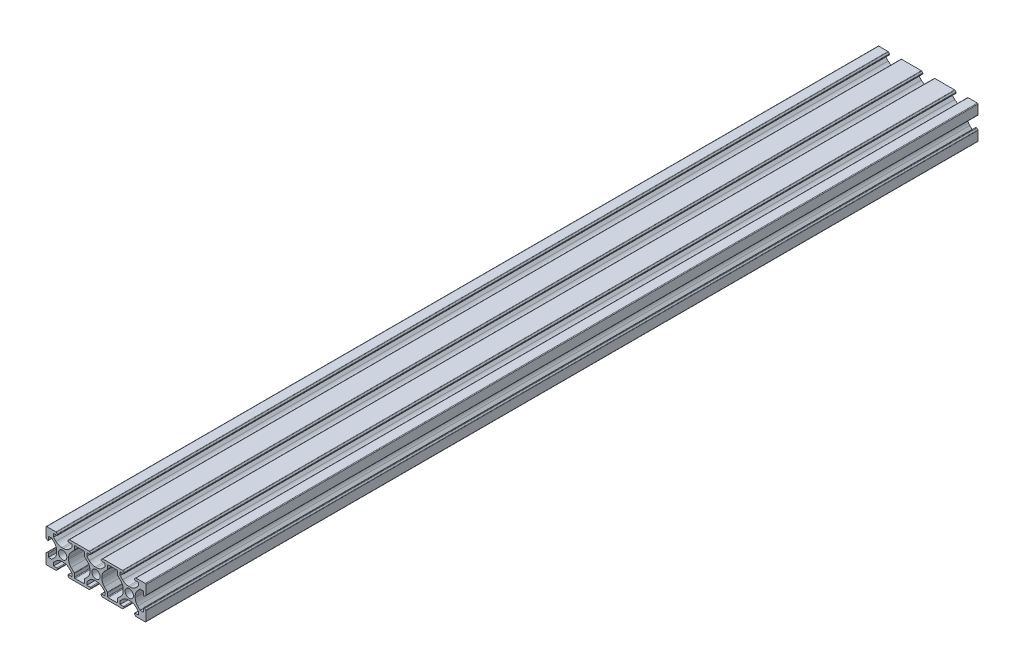
from build123d import *

# Parameters (mm, degrees)
RESSALTO_EXTRUS_O1_DEPTH    = 500
PADR_OCIRCULAR1_COUNT       = 4
PADR_O_LINEAR1_COUNT        = 3
PADR_O_LINEAR1_PITCH        = 20
PADR_O_LINEAR1_COPY_1_DEPTH = 500
PADR_O_LINEAR1_COPY_2_DEPTH = 500
PADR_O_LINEAR1_COPY_3_DEPTH = 500
PADR_O_LINEAR1_COPY_4_DEPTH = 500
PADR_O_LINEAR1_COPY_5_DEPTH = 500
PADR_O_LINEAR1_COPY_6_DEPTH = 500
CORTE_EXTRUS_O1_DEPTH       = 503.593274925
PADR_O_LINEAR2_COUNT        = 2
PADR_O_LINEAR2_PITCH        = 20
FILETE1_R                   = 0.4
FILETE2_R                   = 0.4


with BuildPart() as part:
    # Esboço1 → Ressalto-extrusão1 (new body)
    with BuildSketch(Plane.XY):
        with BuildLine():
            ThreePointArc((-9.317157288, 3.217157288), (-9.187387948, 3.130448187), (-9.034314575, 3.1))
            Line((-9.034314575, 3.1), (-8.9, 3.1))
            ThreePointArc((-8.9, 3.1), (-8.617157288, 3.217157288), (-8.5, 3.5))
            Line((-8.5, 3.5), (-8.5, 5.5))
            Line((-8.5, 5.5), (-6.560660172, 5.5))
            Line((-6.560660172, 5.5), (-5.064466094, 4.003805922))
            ThreePointArc((-5.064466094, 4.003805922), (-3.980602337, 2.381689178), (-3.6, 0.468272016))
            Line((-3.6, 0.468272016), (-3.6, 0))
            Line((-3.6, 0), (-2.5, 0))
            ThreePointArc((-2.5, 0), (-1.767766953, 1.767766953), (0, 2.5))
            Line((0, 2.5), (0, 3.6))
            Line((0, 3.6), (-0.468272016, 3.6))
            ThreePointArc((-0.468272016, 3.6), (-2.381689178, 3.980602337), (-4.003805922, 5.064466094))
            Line((-4.003805922, 5.064466094), (-5.5, 6.560660172))
            Line((-5.5, 6.560660172), (-5.5, 8.5))
            Line((-5.5, 8.5), (-3.5, 8.5))
            ThreePointArc((-3.5, 8.5), (-3.217157288, 8.617157288), (-3.1, 8.9))
            Line((-3.1, 8.9), (-3.1, 9.034314575))
            ThreePointArc((-3.1, 9.034314575), (-3.130448187, 9.187387948), (-3.217157288, 9.317157288))
            Line((-3.217157288, 9.317157288), (-3.782842712, 9.882842712))
            ThreePointArc((-3.782842712, 9.882842712), (-3.912612052, 9.969551813), (-4.065685425, 10))
            Line((-4.065685425, 10), (-10, 10))
            Line((-10, 10), (-10, 4.065685425))
            ThreePointArc((-10, 4.065685425), (-9.969551813, 3.912612052), (-9.882842712, 3.782842712))
            Line((-9.882842712, 3.782842712), (-9.317157288, 3.217157288))
        make_face()
    ressalto_extrus_o1 = extrude(amount=RESSALTO_EXTRUS_O1_DEPTH)

    # PadrãoCircular1: Ressalto-extrusão1 ×4 about axis
    padr_ocircular1_axis = Axis((0, 0, 0), (0, 0, 1))
    for i in range(1, PADR_OCIRCULAR1_COUNT):
        add(ressalto_extrus_o1.rotate(padr_ocircular1_axis, i * 360 / PADR_OCIRCULAR1_COUNT))

    # Padrão linear1: Ressalto-extrusão1 ×3
    with Locations(*[(i * PADR_O_LINEAR1_PITCH, 0, 0) for i in range(1, PADR_O_LINEAR1_COUNT)]):
        add(ressalto_extrus_o1)

    # Padrão linear1 copy 1 sketch → Padrão linear1 copy 1 (add)
    with BuildSketch(Plane(origin=(20, 0, 0), x_dir=(0, 1, 0), z_dir=(0, 0, 1))):
        with BuildLine():
            ThreePointArc((-9.317157288, 3.217157288), (-9.187387948, 3.130448187), (-9.034314575, 3.1))
            Line((-9.034314575, 3.1), (-8.9, 3.1))
            ThreePointArc((-8.9, 3.1), (-8.617157288, 3.217157288), (-8.5, 3.5))
            Line((-8.5, 3.5), (-8.5, 5.5))
            Line((-8.5, 5.5), (-6.560660172, 5.5))
            Line((-6.560660172, 5.5), (-5.064466094, 4.003805922))
            ThreePointArc((-5.064466094, 4.003805922), (-3.980602337, 2.381689178), (-3.6, 0.468272016))
            Line((-3.6, 0.468272016), (-3.6, 0))
            Line((-3.6, 0), (-2.5, 0))
            ThreePointArc((-2.5, 0), (-1.767766953, 1.767766953), (0, 2.5))
            Line((0, 2.5), (0, 3.6))
            Line((0, 3.6), (-0.468272016, 3.6))
            ThreePointArc((-0.468272016, 3.6), (-2.381689178, 3.980602337), (-4.003805922, 5.064466094))
            Line((-4.003805922, 5.064466094), (-5.5, 6.560660172))
            Line((-5.5, 6.560660172), (-5.5, 8.5))
            Line((-5.5, 8.5), (-3.5, 8.5))
            ThreePointArc((-3.5, 8.5), (-3.217157288, 8.617157288), (-3.1, 8.9))
            Line((-3.1, 8.9), (-3.1, 9.034314575))
            ThreePointArc((-3.1, 9.034314575), (-3.130448187, 9.187387948), (-3.217157288, 9.317157288))
            Line((-3.217157288, 9.317157288), (-3.782842712, 9.882842712))
            ThreePointArc((-3.782842712, 9.882842712), (-3.912612052, 9.969551813), (-4.065685425, 10))
            Line((-4.065685425, 10), (-10, 10))
            Line((-10, 10), (-10, 4.065685425))
            ThreePointArc((-10, 4.065685425), (-9.969551813, 3.912612052), (-9.882842712, 3.782842712))
            Line((-9.882842712, 3.782842712), (-9.317157288, 3.217157288))
        make_face()
    extrude(amount=PADR_O_LINEAR1_COPY_1_DEPTH)

    # Padrão linear1 copy 2 sketch → Padrão linear1 copy 2 (add)
    with BuildSketch(Plane(origin=(40, 0, 0), x_dir=(0, 1, 0), z_dir=(0, 0, 1))):
        with BuildLine():
            ThreePointArc((-9.317157288, 3.217157288), (-9.187387948, 3.130448187), (-9.034314575, 3.1))
            Line((-9.034314575, 3.1), (-8.9, 3.1))
            ThreePointArc((-8.9, 3.1), (-8.617157288, 3.217157288), (-8.5, 3.5))
            Line((-8.5, 3.5), (-8.5, 5.5))
            Line((-8.5, 5.5), (-6.560660172, 5.5))
            Line((-6.560660172, 5.5), (-5.064466094, 4.003805922))
            ThreePointArc((-5.064466094, 4.003805922), (-3.980602337, 2.381689178), (-3.6, 0.468272016))
            Line((-3.6, 0.468272016), (-3.6, 0))
            Line((-3.6, 0), (-2.5, 0))
            ThreePointArc((-2.5, 0), (-1.767766953, 1.767766953), (0, 2.5))
            Line((0, 2.5), (0, 3.6))
            Line((0, 3.6), (-0.468272016, 3.6))
            ThreePointArc((-0.468272016, 3.6), (-2.381689178, 3.980602337), (-4.003805922, 5.064466094))
            Line((-4.003805922, 5.064466094), (-5.5, 6.560660172))
            Line((-5.5, 6.560660172), (-5.5, 8.5))
            Line((-5.5, 8.5), (-3.5, 8.5))
            ThreePointArc((-3.5, 8.5), (-3.217157288, 8.617157288), (-3.1, 8.9))
            Line((-3.1, 8.9), (-3.1, 9.034314575))
            ThreePointArc((-3.1, 9.034314575), (-3.130448187, 9.187387948), (-3.217157288, 9.317157288))
            Line((-3.217157288, 9.317157288), (-3.782842712, 9.882842712))
            ThreePointArc((-3.782842712, 9.882842712), (-3.912612052, 9.969551813), (-4.065685425, 10))
            Line((-4.065685425, 10), (-10, 10))
            Line((-10, 10), (-10, 4.065685425))
            ThreePointArc((-10, 4.065685425), (-9.969551813, 3.912612052), (-9.882842712, 3.782842712))
            Line((-9.882842712, 3.782842712), (-9.317157288, 3.217157288))
        make_face()
    extrude(amount=PADR_O_LINEAR1_COPY_2_DEPTH)

    # Padrão linear1 copy 3 sketch → Padrão linear1 copy 3 (add)
    with BuildSketch(Plane(origin=(20, 0, 0), x_dir=(-1, 0, 0), z_dir=(0, 0, 1))):
        with BuildLine():
            ThreePointArc((-9.317157288, 3.217157288), (-9.187387948, 3.130448187), (-9.034314575, 3.1))
            Line((-9.034314575, 3.1), (-8.9, 3.1))
            ThreePointArc((-8.9, 3.1), (-8.617157288, 3.217157288), (-8.5, 3.5))
            Line((-8.5, 3.5), (-8.5, 5.5))
            Line((-8.5, 5.5), (-6.560660172, 5.5))
            Line((-6.560660172, 5.5), (-5.064466094, 4.003805922))
            ThreePointArc((-5.064466094, 4.003805922), (-3.980602337, 2.381689178), (-3.6, 0.468272016))
            Line((-3.6, 0.468272016), (-3.6, 0))
            Line((-3.6, 0), (-2.5, 0))
            ThreePointArc((-2.5, 0), (-1.767766953, 1.767766953), (0, 2.5))
            Line((0, 2.5), (0, 3.6))
            Line((0, 3.6), (-0.468272016, 3.6))
            ThreePointArc((-0.468272016, 3.6), (-2.381689178, 3.980602337), (-4.003805922, 5.064466094))
            Line((-4.003805922, 5.064466094), (-5.5, 6.560660172))
            Line((-5.5, 6.560660172), (-5.5, 8.5))
            Line((-5.5, 8.5), (-3.5, 8.5))
            ThreePointArc((-3.5, 8.5), (-3.217157288, 8.617157288), (-3.1, 8.9))
            Line((-3.1, 8.9), (-3.1, 9.034314575))
            ThreePointArc((-3.1, 9.034314575), (-3.130448187, 9.187387948), (-3.217157288, 9.317157288))
            Line((-3.217157288, 9.317157288), (-3.782842712, 9.882842712))
            ThreePointArc((-3.782842712, 9.882842712), (-3.912612052, 9.969551813), (-4.065685425, 10))
            Line((-4.065685425, 10), (-10, 10))
            Line((-10, 10), (-10, 4.065685425))
            ThreePointArc((-10, 4.065685425), (-9.969551813, 3.912612052), (-9.882842712, 3.782842712))
            Line((-9.882842712, 3.782842712), (-9.317157288, 3.217157288))
        make_face()
    extrude(amount=PADR_O_LINEAR1_COPY_3_DEPTH)

    # Padrão linear1 copy 4 sketch → Padrão linear1 copy 4 (add)
    with BuildSketch(Plane(origin=(40, 0, 0), x_dir=(-1, 0, 0), z_dir=(0, 0, 1))):
        with BuildLine():
            ThreePointArc((-9.317157288, 3.217157288), (-9.187387948, 3.130448187), (-9.034314575, 3.1))
            Line((-9.034314575, 3.1), (-8.9, 3.1))
            ThreePointArc((-8.9, 3.1), (-8.617157288, 3.217157288), (-8.5, 3.5))
            Line((-8.5, 3.5), (-8.5, 5.5))
            Line((-8.5, 5.5), (-6.560660172, 5.5))
            Line((-6.560660172, 5.5), (-5.064466094, 4.003805922))
            ThreePointArc((-5.064466094, 4.003805922), (-3.980602337, 2.381689178), (-3.6, 0.468272016))
            Line((-3.6, 0.468272016), (-3.6, 0))
            Line((-3.6, 0), (-2.5, 0))
            ThreePointArc((-2.5, 0), (-1.767766953, 1.767766953), (0, 2.5))
            Line((0, 2.5), (0, 3.6))
            Line((0, 3.6), (-0.468272016, 3.6))
            ThreePointArc((-0.468272016, 3.6), (-2.381689178, 3.980602337), (-4.003805922, 5.064466094))
            Line((-4.003805922, 5.064466094), (-5.5, 6.560660172))
            Line((-5.5, 6.560660172), (-5.5, 8.5))
            Line((-5.5, 8.5), (-3.5, 8.5))
            ThreePointArc((-3.5, 8.5), (-3.217157288, 8.617157288), (-3.1, 8.9))
            Line((-3.1, 8.9), (-3.1, 9.034314575))
            ThreePointArc((-3.1, 9.034314575), (-3.130448187, 9.187387948), (-3.217157288, 9.317157288))
            Line((-3.217157288, 9.317157288), (-3.782842712, 9.882842712))
            ThreePointArc((-3.782842712, 9.882842712), (-3.912612052, 9.969551813), (-4.065685425, 10))
            Line((-4.065685425, 10), (-10, 10))
            Line((-10, 10), (-10, 4.065685425))
            ThreePointArc((-10, 4.065685425), (-9.969551813, 3.912612052), (-9.882842712, 3.782842712))
            Line((-9.882842712, 3.782842712), (-9.317157288, 3.217157288))
        make_face()
    extrude(amount=PADR_O_LINEAR1_COPY_4_DEPTH)

    # Padrão linear1 copy 5 sketch → Padrão linear1 copy 5 (add)
    with BuildSketch(Plane(origin=(20, 0, 0), x_dir=(0, -1, 0), z_dir=(0, 0, 1))):
        with BuildLine():
            ThreePointArc((-9.317157288, 3.217157288), (-9.187387948, 3.130448187), (-9.034314575, 3.1))
            Line((-9.034314575, 3.1), (-8.9, 3.1))
            ThreePointArc((-8.9, 3.1), (-8.617157288, 3.217157288), (-8.5, 3.5))
            Line((-8.5, 3.5), (-8.5, 5.5))
            Line((-8.5, 5.5), (-6.560660172, 5.5))
            Line((-6.560660172, 5.5), (-5.064466094, 4.003805922))
            ThreePointArc((-5.064466094, 4.003805922), (-3.980602337, 2.381689178), (-3.6, 0.468272016))
            Line((-3.6, 0.468272016), (-3.6, 0))
            Line((-3.6, 0), (-2.5, 0))
            ThreePointArc((-2.5, 0), (-1.767766953, 1.767766953), (0, 2.5))
            Line((0, 2.5), (0, 3.6))
            Line((0, 3.6), (-0.468272016, 3.6))
            ThreePointArc((-0.468272016, 3.6), (-2.381689178, 3.980602337), (-4.003805922, 5.064466094))
            Line((-4.003805922, 5.064466094), (-5.5, 6.560660172))
            Line((-5.5, 6.560660172), (-5.5, 8.5))
            Line((-5.5, 8.5), (-3.5, 8.5))
            ThreePointArc((-3.5, 8.5), (-3.217157288, 8.617157288), (-3.1, 8.9))
            Line((-3.1, 8.9), (-3.1, 9.034314575))
            ThreePointArc((-3.1, 9.034314575), (-3.130448187, 9.187387948), (-3.217157288, 9.317157288))
            Line((-3.217157288, 9.317157288), (-3.782842712, 9.882842712))
            ThreePointArc((-3.782842712, 9.882842712), (-3.912612052, 9.969551813), (-4.065685425, 10))
            Line((-4.065685425, 10), (-10, 10))
            Line((-10, 10), (-10, 4.065685425))
            ThreePointArc((-10, 4.065685425), (-9.969551813, 3.912612052), (-9.882842712, 3.782842712))
            Line((-9.882842712, 3.782842712), (-9.317157288, 3.217157288))
        make_face()
    extrude(amount=PADR_O_LINEAR1_COPY_5_DEPTH)

    # Padrão linear1 copy 6 sketch → Padrão linear1 copy 6 (add)
    with BuildSketch(Plane(origin=(40, 0, 0), x_dir=(0, -1, 0), z_dir=(0, 0, 1))):
        with BuildLine():
            ThreePointArc((-9.317157288, 3.217157288), (-9.187387948, 3.130448187), (-9.034314575, 3.1))
            Line((-9.034314575, 3.1), (-8.9, 3.1))
            ThreePointArc((-8.9, 3.1), (-8.617157288, 3.217157288), (-8.5, 3.5))
            Line((-8.5, 3.5), (-8.5, 5.5))
            Line((-8.5, 5.5), (-6.560660172, 5.5))
            Line((-6.560660172, 5.5), (-5.064466094, 4.003805922))
            ThreePointArc((-5.064466094, 4.003805922), (-3.980602337, 2.381689178), (-3.6, 0.468272016))
            Line((-3.6, 0.468272016), (-3.6, 0))
            Line((-3.6, 0), (-2.5, 0))
            ThreePointArc((-2.5, 0), (-1.767766953, 1.767766953), (0, 2.5))
            Line((0, 2.5), (0, 3.6))
            Line((0, 3.6), (-0.468272016, 3.6))
            ThreePointArc((-0.468272016, 3.6), (-2.381689178, 3.980602337), (-4.003805922, 5.064466094))
            Line((-4.003805922, 5.064466094), (-5.5, 6.560660172))
            Line((-5.5, 6.560660172), (-5.5, 8.5))
            Line((-5.5, 8.5), (-3.5, 8.5))
            ThreePointArc((-3.5, 8.5), (-3.217157288, 8.617157288), (-3.1, 8.9))
            Line((-3.1, 8.9), (-3.1, 9.034314575))
            ThreePointArc((-3.1, 9.034314575), (-3.130448187, 9.187387948), (-3.217157288, 9.317157288))
            Line((-3.217157288, 9.317157288), (-3.782842712, 9.882842712))
            ThreePointArc((-3.782842712, 9.882842712), (-3.912612052, 9.969551813), (-4.065685425, 10))
            Line((-4.065685425, 10), (-10, 10))
            Line((-10, 10), (-10, 4.065685425))
            ThreePointArc((-10, 4.065685425), (-9.969551813, 3.912612052), (-9.882842712, 3.782842712))
            Line((-9.882842712, 3.782842712), (-9.317157288, 3.217157288))
        make_face()
    extrude(amount=PADR_O_LINEAR1_COPY_6_DEPTH)

    # Esboço4 → Corte-extrusão1 (cut, through all)
    with BuildSketch(Plane(origin=(0, 0, 0), x_dir=(-1, 0, 0), z_dir=(0, 0, -1))):
        Polygon((-13.439339828, 5.5), (-13, 5.939339828), (-13, 8.5), (-7, 8.5), (-7, 5.939339828), (-6.560660172, 5.5), (-6.560660172, -5.5), (-7, -5.939339828), (-7, -8.5), (-13, -8.5), (-13, -5.939339828), (-13.439339828, -5.5), align=None)
    corte_extrus_o1 = extrude(amount=-CORTE_EXTRUS_O1_DEPTH, mode=Mode.SUBTRACT)

    # Padrão linear2: Corte-extrusão1 ×2
    with Locations(*[(i * PADR_O_LINEAR2_PITCH, 0, 0) for i in range(1, PADR_O_LINEAR2_COUNT)]):
        add(corte_extrus_o1, mode=Mode.SUBTRACT)

    # Filete1
    filete1_edges = [part.edges().sort_by_distance(p)[0] for p in [
        (13, 5.939339828, 250),
        (13, 8.5, 250),
        (7, 8.5, 250),
        (7, 5.939339828, 250),
        (7, -5.939339828, 250),
        (7, -8.5, 250),
        (13, -8.5, 250),
        (13, -5.939339828, 250),
        (33, 5.939339828, 250),
        (33, 8.5, 250),
        (27, 8.5, 250),
        (27, 5.939339828, 250),
        (27, -5.939339828, 250),
        (27, -8.5, 250),
        (33, -8.5, 250),
        (33, -5.939339828, 250),
    ]]
    fillet(filete1_edges, radius=FILETE1_R)

    # Filete2
    filete2_edges = [part.edges().sort_by_distance(p)[0] for p in [
        (-10, 10, 250),
        (50, -10, 250),
        (50, 10, 250),
        (-10, -10, 250),
    ]]
    fillet(filete2_edges, radius=FILETE2_R)


solid = part.part
